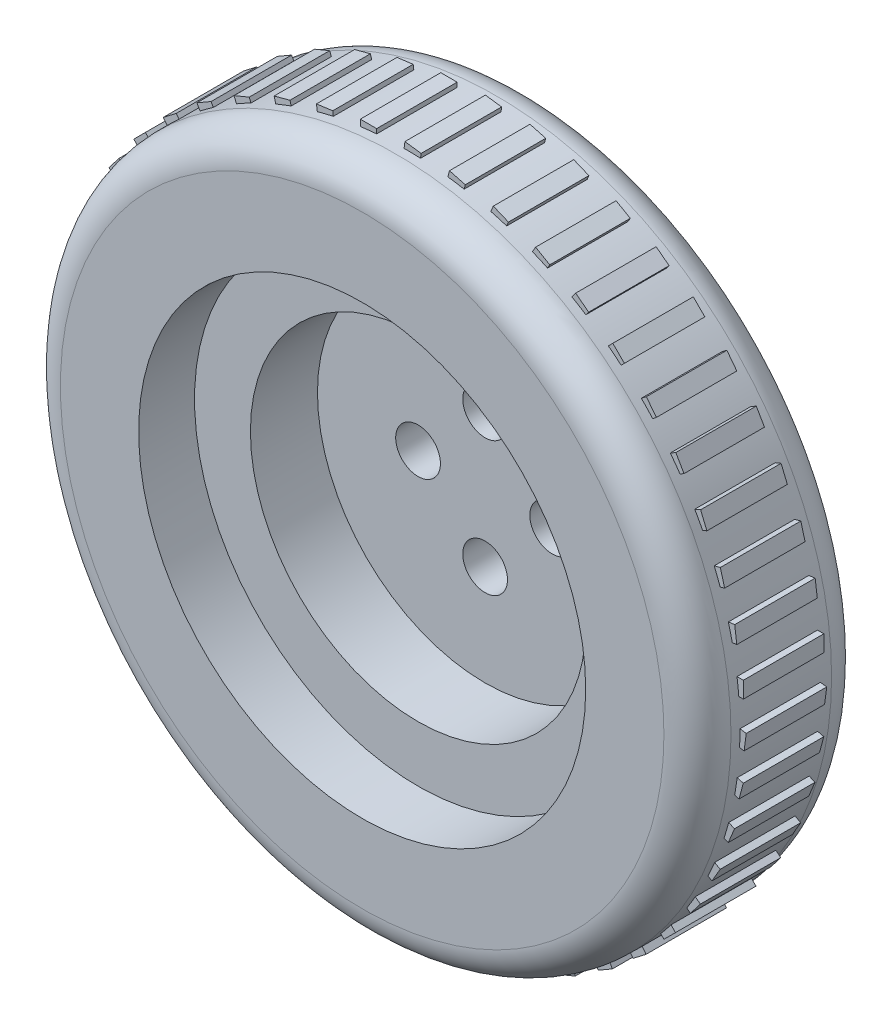
from build123d import *

# Parameters (mm, degrees)
SKETCH_1_R               = 30
EXTRUDE_1_DEPTH          = 15
SKETCH_2_R               = 20
CUT_EXTRUDE_1_DEPTH      = 5
SKETCH_3_R               = 2
CUT_EXTRUDE_2_DEPTH      = 44.588989435
SKETCH_5_R               = 15
CUT_EXTRUDE_3_DEPTH      = 6
FILLET_1_R               = 3
SKETCH_7_W               = 1.464734348
SKETCH_7_H               = 1.132930067
EXTRUDE_2_DEPTH          = 7.2
PATTERN_CIRCULAR_1_COUNT = 48


with BuildPart() as part:
    # 草圖1 → 填料-伸長1 (new body)
    with BuildSketch(Plane.XY):
        Circle(SKETCH_1_R)
    extrude(amount=EXTRUDE_1_DEPTH)

    # 草圖2 → 除料-伸長1 (cut)
    with BuildSketch(Plane.XY.offset(15)):
        Circle(SKETCH_2_R)
    extrude(amount=-CUT_EXTRUDE_1_DEPTH, mode=Mode.SUBTRACT)

    # 草圖3 → 除料-伸長2 (cut, through all)
    with BuildSketch(Plane.XY.offset(10)):
        with Locations((6, 0)):
            Circle(SKETCH_3_R)
        with Locations((-6, 0)):
            Circle(SKETCH_3_R)
        with Locations((0, 6)):
            Circle(SKETCH_3_R)
        with Locations((0, -6)):
            Circle(SKETCH_3_R)
    extrude(amount=-CUT_EXTRUDE_2_DEPTH, mode=Mode.SUBTRACT)

    # 草圖5 → 除料-伸長3 (cut)
    with BuildSketch(Plane.XY.offset(10)):
        Circle(SKETCH_5_R)
    extrude(amount=-CUT_EXTRUDE_3_DEPTH, mode=Mode.SUBTRACT)

    # 圓角1
    fillet_1_edges = [part.edges().sort_by_distance(p)[0] for p in [
        (-30, 0, 0),
        (-30, 0, 15),
    ]]
    fillet(fillet_1_edges, radius=FILLET_1_R)

    # 草圖7 → 填料-伸長2 (add)
    with BuildSketch(Plane.XY.offset(4)):
        with Locations((-3.234621685, 29.739414259)):
            Rectangle(SKETCH_7_W, SKETCH_7_H)
    extrude_2 = extrude(amount=EXTRUDE_2_DEPTH)

    # 環狀複製排列1: 填料-伸長2 ×48 about axis
    pattern_circular_1_axis = Axis((0, 0, 0), (0, 0, 1))
    for i in range(1, PATTERN_CIRCULAR_1_COUNT):
        add(extrude_2.rotate(pattern_circular_1_axis, i * 360 / PATTERN_CIRCULAR_1_COUNT))


solid = part.part
